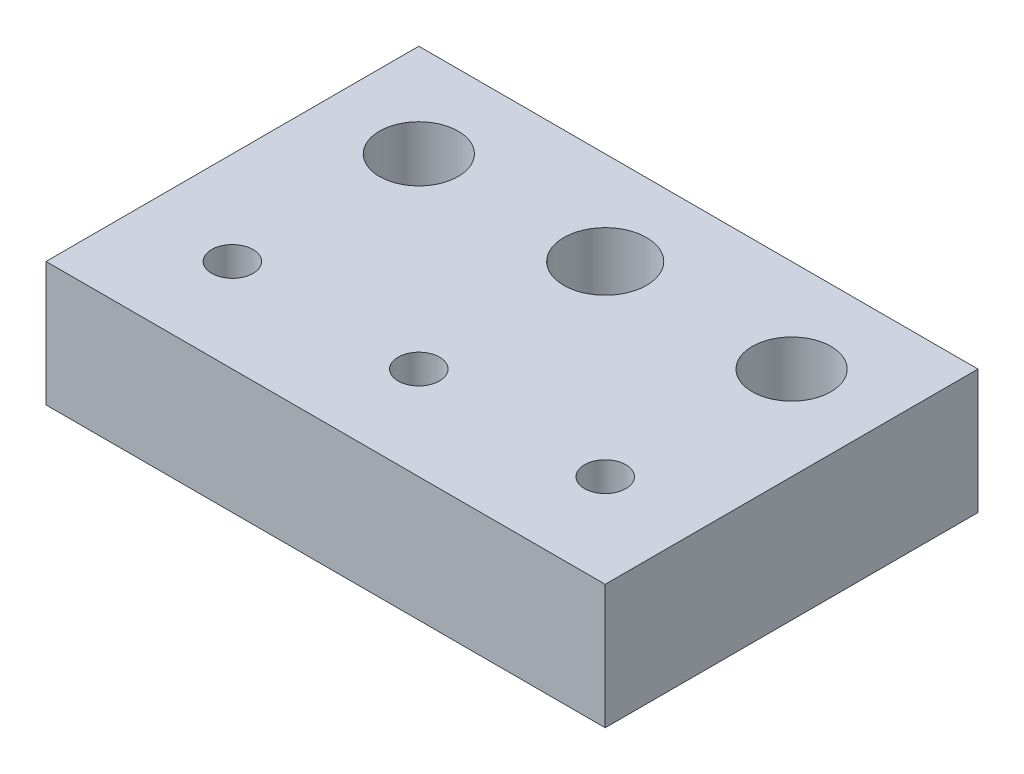
from build123d import *

# Parameters (mm, degrees)
SKETCH1_W           = 135
SKETCH1_H           = 90
SKETCH1_R           = 10
SKETCH1_R_2         = 5
BOSS_EXTRUDE2_DEPTH = 30
SKETCH2_R           = 9.5
CUT_EXTRUDE2_DEPTH  = 20
SKETCH3_R           = 8
CUT_EXTRUDE3_DEPTH  = 10


with BuildPart() as part:
    # Sketch1 → Boss-Extrude2 (new body)
    with BuildSketch(Plane(origin=(0, 0, 0), x_dir=(1, 0, 0), z_dir=(0, 1, 0))):
        Rectangle(SKETCH1_W, SKETCH1_H)
        with Locations(Location((0, 22.5, 0), (0, 0, 270))):
            Circle(SKETCH1_R, mode=Mode.SUBTRACT)
        with Locations(Location((0, -22.5, 0), (0, 0, 270))):
            Circle(SKETCH1_R_2, mode=Mode.SUBTRACT)
        with Locations(Location((-45, -22.5, 0), (0, 0, 270))):
            Circle(SKETCH1_R_2, mode=Mode.SUBTRACT)
        with Locations(Location((45, -22.5, 0), (0, 0, 270))):
            Circle(SKETCH1_R_2, mode=Mode.SUBTRACT)
    extrude(amount=BOSS_EXTRUDE2_DEPTH)

    # Sketch2 → Cut-Extrude2 (cut)
    with BuildSketch(Plane(origin=(0, 30, 0), x_dir=(1, 0, 0), z_dir=(0, 1, 0))):
        with Locations(Location((-45, 22.5, 0), (0, 0, 270))):
            Circle(SKETCH2_R)
        with Locations(Location((45, 22.5, 0), (0, 0, 90))):
            Circle(SKETCH2_R)
    extrude(amount=-CUT_EXTRUDE2_DEPTH, mode=Mode.SUBTRACT)

    # Sketch3 → Cut-Extrude3 (cut)
    with BuildSketch(Plane.XZ):
        with Locations(Location((45, 22.5, 0), (0, 0, 270))):
            Circle(SKETCH3_R)
        with Locations(Location((0, 22.5, 0), (0, 0, 270))):
            Circle(SKETCH3_R)
        with Locations(Location((-45, 22.5, 0), (0, 0, 90))):
            Circle(SKETCH3_R)
    extrude(amount=-CUT_EXTRUDE3_DEPTH, mode=Mode.SUBTRACT)


solid = part.part
